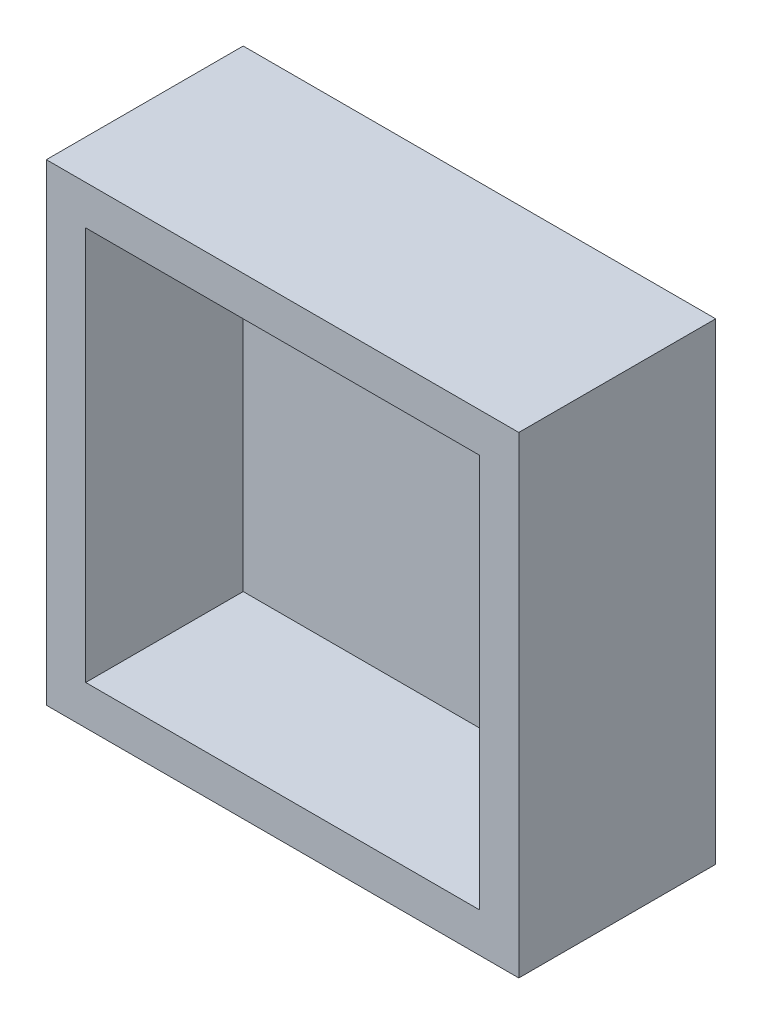
from build123d import *

# Parameters (mm, degrees)
SKETCH_1_W      = 20
SKETCH_1_H      = 20
EXTRUDE_1_DEPTH = 2
SKETCH_2_W      = 20
SKETCH_2_H      = 10
EXTRUDE_3_DEPTH = 2
SKETCH_4_W      = 20
SKETCH_4_H      = 10
EXTRUDE_4_DEPTH = 2
SKETCH_5_W      = 10
SKETCH_5_H      = 24
EXTRUDE_5_DEPTH = 2
SKETCH_6_W      = 10
SKETCH_6_H      = 24
EXTRUDE_6_DEPTH = 2


with BuildPart() as part:
    # 草图1 → 凸台-拉伸1 (new body)
    with BuildSketch(Plane.XY):
        Rectangle(SKETCH_1_W, SKETCH_1_H)
    extrude(amount=EXTRUDE_1_DEPTH)

    # 草图2 → 凸台-拉伸3 (add)
    with BuildSketch(Plane.XZ.offset(10)):
        with Locations((0, 5)):
            Rectangle(SKETCH_2_W, SKETCH_2_H)
    extrude(amount=EXTRUDE_3_DEPTH)

    # 草图4 → 凸台-拉伸4 (add)
    with BuildSketch(Plane(origin=(0, 10, 0), x_dir=(1, 0, 0), z_dir=(0, 1, 0))):
        with Locations((0, -5)):
            Rectangle(SKETCH_4_W, SKETCH_4_H)
    extrude(amount=EXTRUDE_4_DEPTH)

    # 草图5 → 凸台-拉伸5 (add)
    with BuildSketch(Plane(origin=(10, 0, 0), x_dir=(0, 0, -1), z_dir=(1, 0, 0))):
        with Locations((-5, 0)):
            Rectangle(SKETCH_5_W, SKETCH_5_H)
    extrude(amount=EXTRUDE_5_DEPTH)

    # 草图6 → 凸台-拉伸6 (add)
    with BuildSketch(Plane.ZY.offset(10)):
        with Locations((5, 0)):
            Rectangle(SKETCH_6_W, SKETCH_6_H)
    extrude(amount=EXTRUDE_6_DEPTH)


solid = part.part
